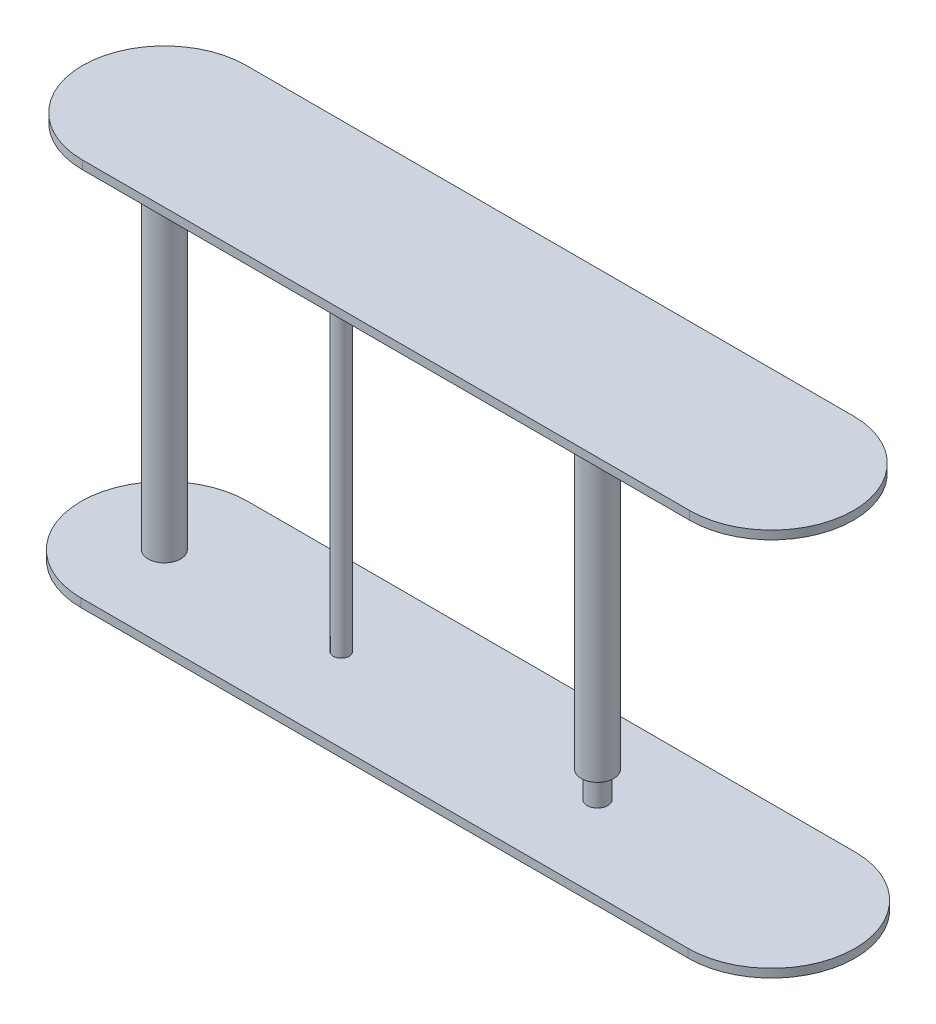
from build123d import *

# Parameters (mm, degrees)
BOSS_EXTRUDE1_DEPTH = 3.2
SKETCH8_R           = 6.15
BOSS_EXTRUDE5_DEPTH = 140
BOSS_EXTRUDE6_DEPTH = 3.2
SKETCH12_R          = 3
BOSS_EXTRUDE7_DEPTH = 140
SKETCH14_R          = 3.9
BOSS_EXTRUDE8_DEPTH = 10
SKETCH15_R          = 6.15
BOSS_EXTRUDE9_DEPTH = 60


with BuildPart() as part:
    # Sketch1 → Boss-Extrude1 (new body)
    with BuildSketch(Plane(origin=(0, 0, 0), x_dir=(1, 0, 0), z_dir=(0, 1, 0))):
        with BuildLine():
            Line((-110.589063221, 31.6), (119.210936779, 31.6))
            ThreePointArc((119.210936779, 31.6), (150.810936779, 0), (119.210936779, -31.6))
            Line((119.210936779, -31.6), (-110.589063221, -31.6))
            ThreePointArc((-110.589063221, -31.6), (-142.189063221, 0), (-110.589063221, 31.6))
        make_face()
    extrude(amount=BOSS_EXTRUDE1_DEPTH)

    # Sketch8 → Boss-Extrude5 (add)
    with BuildSketch(Plane(origin=(0, 3.2, 0), x_dir=(1, 0, 0), z_dir=(0, 1, 0))):
        with Locations(Location((-110.589063221, 0, 0), (0, 0, 270))):
            Circle(SKETCH8_R)
    extrude(amount=BOSS_EXTRUDE5_DEPTH)

    # Sketch11 → Boss-Extrude6 (add)
    with BuildSketch(Plane(origin=(0, 143.2, 0), x_dir=(1, 0, 0), z_dir=(0, 1, 0))):
        with BuildLine():
            Line((-110.589063221, 30.988193708), (119.210936779, 30.988193708))
            ThreePointArc((119.210936779, 30.988193708), (150.199130487, 0), (119.210936779, -30.988193708))
            Line((119.210936779, -30.988193708), (-110.589063221, -30.988193708))
            ThreePointArc((-110.589063221, -30.988193708), (-141.577256929, 0), (-110.589063221, 30.988193708))
        make_face()
    extrude(amount=BOSS_EXTRUDE6_DEPTH)

    # Sketch12 → Boss-Extrude7 (add)
    with BuildSketch(Plane(origin=(0, 3.2, 0), x_dir=(1, 0, 0), z_dir=(0, 1, 0))):
        with Locations(Location((-43.639063221, 0, 0), (0, 0, 270))):
            Circle(SKETCH12_R)
    extrude(amount=BOSS_EXTRUDE7_DEPTH)

    # Sketch14 → Boss-Extrude8 (add)
    with BuildSketch(Plane(origin=(0, 3.2, 0), x_dir=(1, 0, 0), z_dir=(0, 1, 0))):
        with Locations(Location((53.310936779, 0, 0), (0, 0, 270))):
            Circle(SKETCH14_R)
    boss_extrude8 = extrude(amount=BOSS_EXTRUDE8_DEPTH)

    # Sketch15 → Boss-Extrude9 (add)
    with BuildSketch(Plane(origin=(0, 13.2, 0), x_dir=(1, 0, 0), z_dir=(0, 1, 0))):
        with Locations(Location((53.310936779, 0, 0), (0, 0, 270))):
            Circle(SKETCH15_R)
    boss_extrude9 = extrude(amount=BOSS_EXTRUDE9_DEPTH)

    # Mirror7: Boss-Extrude8, Boss-Extrude9 across plane
    add(boss_extrude8.mirror(Plane.ZX.offset(73.2)))
    add(boss_extrude9.mirror(Plane.ZX.offset(73.2)))


solid = part.part
